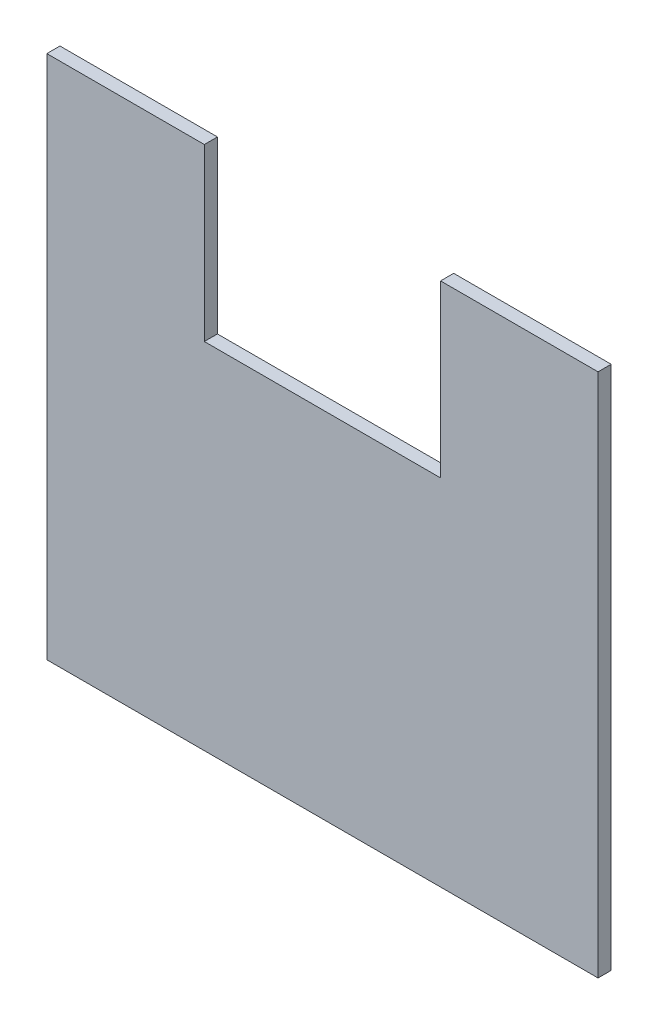
from build123d import *

# Parameters (mm, degrees)
BOSS_EXTRUDE1_DEPTH = 5


with BuildPart() as part:
    # Sketch1 → Boss-Extrude1 (new body)
    with BuildSketch(Plane.XY):
        Polygon((-210, 200), (-150, 200), (-150, 135), (-60, 135), (-60, 200), (0, 200), (0, 0), (-210, 0), align=None)
    extrude(amount=BOSS_EXTRUDE1_DEPTH)


solid = part.part
